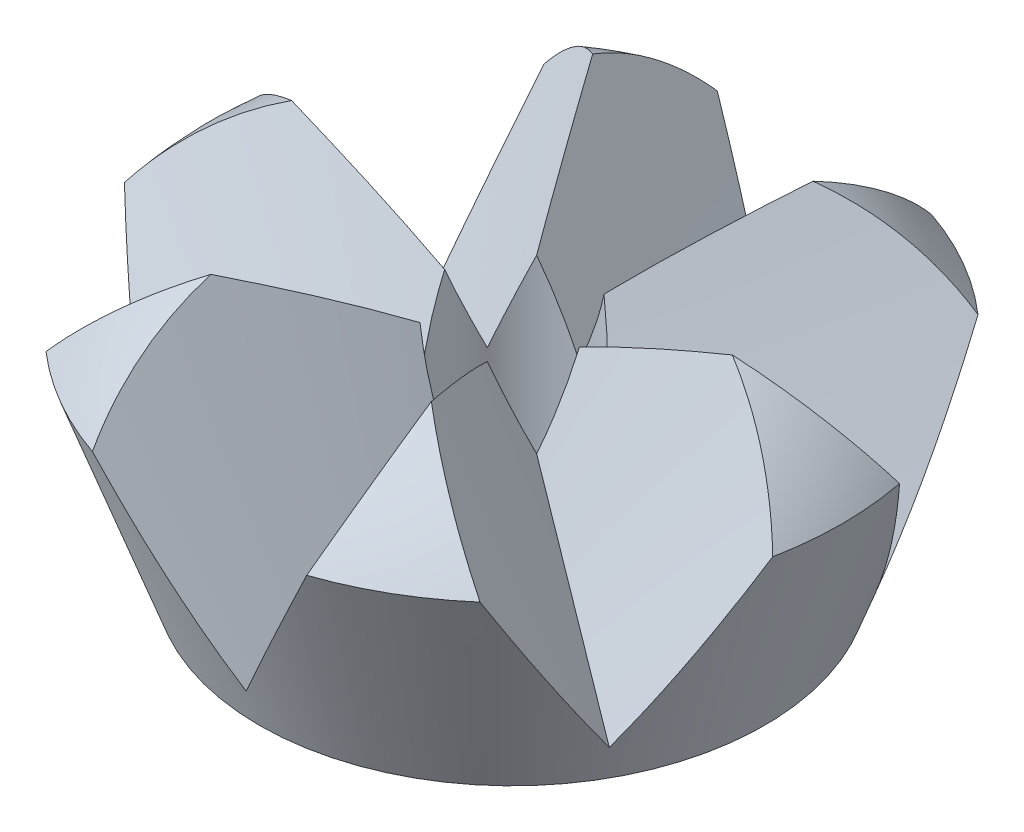
from build123d import *

# Parameters (mm, degrees)
CIRPATTERN2_COUNT = 6


with BuildPart() as part:
    # Sketch1 → Revolve1 (revolve)
    with BuildSketch(Plane.XY, mode=Mode.PRIVATE) as revolve1_sk:
        with BuildLine():
            Line((15, 0), (19.617271935, 12.685850381))
            ThreePointArc((19.617271935, 12.685850381), (12.715607793, 18.28246219), (4, 20.012552493))
            Line((4, 20.012552493), (4, 0))
            Line((4, 0), (15, 0))
        make_face()
    revolve(revolve1_sk.sketch.rotate(Axis((0, 0, 0), (0, 1, 0)), 90), axis=Axis((0, 0, 0), (0, 1, 0)))

    # Sketch2 → Cut-Loft6 section 0
    with BuildSketch(Plane.XY):
        with BuildLine():
            Line((0, 11.599275662), (-4.048944555, 21.318242086))
            Line((-4.048944555, 21.318242086), (0, 25.573074977))
            Line((0, 25.573074977), (4.048944555, 21.318242086))
            Line((4.048944555, 21.318242086), (0, 11.599275662))
        make_face()
    # Sketch3 → Cut-Loft6 section 1
    with BuildSketch(Plane(origin=(0, -4.820907073, 13.245333323), x_dir=(1, 0, 0), z_dir=(0, -0.3420201433256655, 0.9396926207859095))):
        with BuildLine():
            Line((0, 7.424762518), (-10.202531998, 24.411177048))
            Line((-10.202531998, 24.411177048), (0, 28.470823288))
            Line((0, 28.470823288), (10.202531998, 24.411177048))
            Line((10.202531998, 24.411177048), (0, 7.424762518))
        make_face()
    cut_loft6 = loft(mode=Mode.SUBTRACT)

    # CirPattern2: Cut-Loft6 ×6 about axis
    cirpattern2_axis = Axis((0, 0, 0), (0, 1, 0))
    for i in range(1, CIRPATTERN2_COUNT):
        add(cut_loft6.rotate(cirpattern2_axis, i * 360 / CIRPATTERN2_COUNT), mode=Mode.SUBTRACT)


solid = part.part
